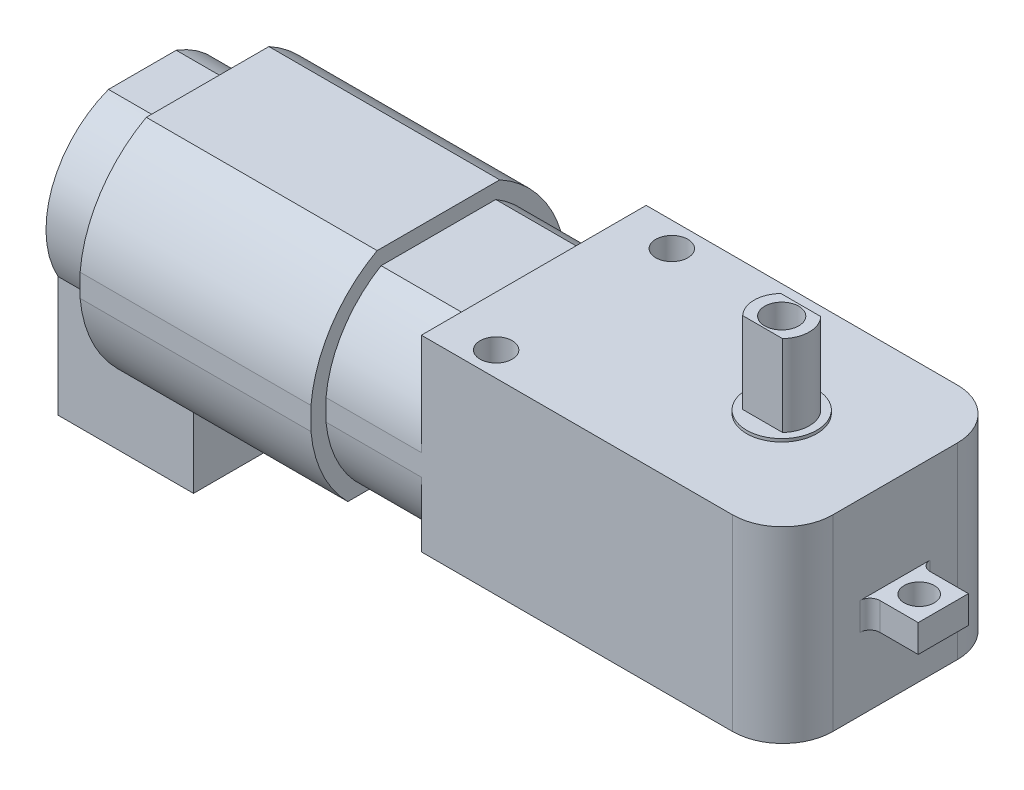
from build123d import *

# Parameters (mm, degrees)
SKETCH1_W                = 36
SKETCH1_H                = 22.4
SKETCH1_R                = 1.6
BOSS_EXTRUDE1_DEPTH      = 9.35
FILLET1_R                = 5
SKETCH2_R                = 3.5
BOSS_EXTRUDE2_DEPTH      = 0.3
BOSS_EXTRUDE4_START      = -0.3
BOSS_EXTRUDE4_DEPTH      = 8.4
M3_CLEARANCE_HOLE1_D     = 3.4
M3_CLEARANCE_HOLE1_DEPTH = 8.0000094
M3_CLEARANCE_HOLE1_TIP   = 1.021463052
BOSS_EXTRUDE5_DEPTH      = 9.5
BOSS_EXTRUDE6_DEPTH      = 23
BOSS_EXTRUDE7_DEPTH      = 13.5
SKETCH11_W               = 3.9
SKETCH11_H               = 13.4
CUT_EXTRUDE1_DEPTH       = 5
SKETCH13_W               = 4.8
SKETCH13_H               = 5
SKETCH13_R               = 1.5
BOSS_EXTRUDE8_DEPTH      = 2.75
FILLET2_R                = 1


with BuildPart() as part:
    # Sketch1 → Boss-Extrude1 (new, symmetric)
    with BuildSketch(Plane(origin=(0, 0, 0), x_dir=(1, 0, 0), z_dir=(0, 1, 0))):
        Rectangle(SKETCH1_W, SKETCH1_H)
        with Locations(Location((-13, 8.75, 0), (0, 0, 270))):
            Circle(SKETCH1_R, mode=Mode.SUBTRACT)
        with Locations(Location((-13, -8.75, 0), (0, 0, 270))):
            Circle(SKETCH1_R, mode=Mode.SUBTRACT)
    extrude(amount=BOSS_EXTRUDE1_DEPTH, both=True)

    # Fillet1
    fillet1_edges = [part.edges().sort_by_distance(p)[0] for p in [
        (18, 0, 11.2),
        (18, 0, -11.2),
    ]]
    fillet(fillet1_edges, radius=FILLET1_R)

    # Sketch2 → Boss-Extrude2 (add)
    with BuildSketch(Plane(origin=(0, 9.35, 0), x_dir=(1, 0, 0), z_dir=(0, 1, 0))):
        with Locations(Location((6.7, 0, 0), (0, 0, 90))):
            Circle(SKETCH2_R)
    extrude(amount=BOSS_EXTRUDE2_DEPTH)

    # Sketch3 → Boss-Extrude4 (add)
    with BuildSketch(Plane(origin=(0, 9.65, 0), x_dir=(1, 0, 0), z_dir=(0, 1, 0)).offset(BOSS_EXTRUDE4_START)):
        with BuildLine():
            ThreePointArc((4.716700981, 1.905), (4.148865713, 1.026749165), (3.95, 0))
            Line((3.95, 0), (9.45, 0))
            ThreePointArc((9.45, 0), (9.251134287, 1.026749165), (8.683299019, 1.905))
            Line((8.683299019, 1.905), (4.716700981, 1.905))
        make_face()
        with BuildLine():
            Line((9.45, 0), (3.95, 0))
            ThreePointArc((3.95, 0), (4.148865713, -1.026749165), (4.716700981, -1.905))
            Line((4.716700981, -1.905), (8.683299019, -1.905))
            ThreePointArc((8.683299019, -1.905), (9.251134287, -1.026749165), (9.45, 0))
        make_face()
    extrude(amount=BOSS_EXTRUDE4_DEPTH)

    # M3 Clearance Hole1
    with Locations(Plane(origin=(6.7, 17.75, 0), x_dir=(0, 0, 1), z_dir=(0, 1, 0))):
        with Locations((0, 0)):
            Hole(M3_CLEARANCE_HOLE1_D / 2, depth=M3_CLEARANCE_HOLE1_DEPTH)
            with Locations((0, 0, -(M3_CLEARANCE_HOLE1_DEPTH + M3_CLEARANCE_HOLE1_TIP / 2))):  # 118° drill point
                Cone(0, M3_CLEARANCE_HOLE1_D / 2, M3_CLEARANCE_HOLE1_TIP, mode=Mode.SUBTRACT)

    # Sketch7 → Boss-Extrude5 (add)
    with BuildSketch(Plane.ZY.offset(18)):
        with BuildLine():
            ThreePointArc((-11.2, -2.901648127), (-10.306415682, -6.352188829), (-8.378242386, -9.35))
            Line((-8.378242386, -9.35), (8.378242386, -9.35))
            ThreePointArc((8.378242386, -9.35), (10.306415682, -6.352188829), (11.2, -2.901648127))
            Line((11.2, -2.901648127), (11.2, -0.782686117))
            ThreePointArc((11.2, -0.782686117), (9.493833141, 4.193529382), (5.711776998, 7.85))
            Line((5.711776998, 7.85), (-5.711776998, 7.85))
            ThreePointArc((-5.711776998, 7.85), (-9.493833141, 4.193529382), (-11.2, -0.782686117))
            Line((-11.2, -0.782686117), (-11.2, -2.901648127))
        make_face()
    extrude(amount=BOSS_EXTRUDE5_DEPTH)

    # Sketch8 → Boss-Extrude6 (add)
    with BuildSketch(Plane.ZY.offset(27.5)):
        with BuildLine():
            Line((12.7, -2.97021854), (12.7, -0.714115705))
            ThreePointArc((12.7, -0.714115705), (10.665331767, 5.144477158), (6.107200268, 9.35))
            Line((6.107200268, 9.35), (-6.107200268, 9.35))
            ThreePointArc((-6.107200268, 9.35), (-10.665331767, 5.144477158), (-12.7, -0.714115705))
            Line((-12.7, -0.714115705), (-12.7, -2.97021854))
            ThreePointArc((-12.7, -2.97021854), (-11.554180407, -7.233216661), (-9.023383337, -10.85))
            Line((-9.023383337, -10.85), (9.023383337, -10.85))
            ThreePointArc((9.023383337, -10.85), (11.554180407, -7.233216661), (12.7, -2.97021854))
        make_face()
    extrude(amount=BOSS_EXTRUDE6_DEPTH)

    # Sketch9 → Boss-Extrude7 (add)
    with BuildSketch(Plane.ZY.offset(57.000000114)):
        with BuildLine():
            Line((-8.4, -1.842167122), (-8.4, -6.489747138))
            ThreePointArc((-8.4, -6.489747138), (0, -11.442167122), (8.4, -6.489747138))
            Line((8.4, -6.489747138), (8.4, -1.842167122))
            Line((8.4, -1.842167122), (-8.4, -1.842167122))
        make_face()
        with BuildLine():
            ThreePointArc((8.4, -6.489747138), (0, -11.442167122), (-8.4, -6.489747138))
            Line((-8.4, -6.489747138), (-8.4, -18.454988755))
            Line((-8.4, -18.454988755), (8.4, -18.454988755))
            Line((8.4, -18.454988755), (8.4, -6.489747138))
        make_face()
        with BuildLine():
            Line((3.375, 7.145011245), (-3.375, 7.145011245))
            ThreePointArc((-3.375, 7.145011245), (-9.007736413, 1.477574541), (-8.4, -6.489747138))
            Line((-8.4, -6.489747138), (-8.4, -1.842167122))
            Line((-8.4, -1.842167122), (8.4, -1.842167122))
            Line((8.4, -1.842167122), (8.4, -6.489747138))
            ThreePointArc((8.4, -6.489747138), (9.295160031, -4.242167122), (9.6, -1.842167122))
            ThreePointArc((9.6, -1.842167122), (7.891767863, 3.624093025), (3.375, 7.145011245))
        make_face()
    extrude(amount=-BOSS_EXTRUDE7_DEPTH)

    # Sketch11 → Cut-Extrude1 (cut)
    with BuildSketch(Plane.XZ.offset(18.454988755)):
        with Locations((-48.450000114, 0)):
            Rectangle(SKETCH11_W, SKETCH11_H)
    extrude(amount=-CUT_EXTRUDE1_DEPTH, mode=Mode.SUBTRACT)

    # Sketch13 → Boss-Extrude8 (add)
    with BuildSketch(Plane(origin=(0, -2.149999922, 0), x_dir=(1, 0, 0), z_dir=(0, 1, 0))):
        with Locations((20.4, 0)):
            Rectangle(SKETCH13_W, SKETCH13_H)
        with Locations(Location((20.4, 0, 0), (0, 0, 270))):
            Circle(SKETCH13_R, mode=Mode.SUBTRACT)
    extrude(amount=BOSS_EXTRUDE8_DEPTH)

    # Fillet2
    fillet2_edges = [part.edges().sort_by_distance(p)[0] for p in [
        (18, -0.774999922, -2.5),
        (18, -0.774999922, 2.5),
    ]]
    fillet(fillet2_edges, radius=FILLET2_R)


solid = part.part
